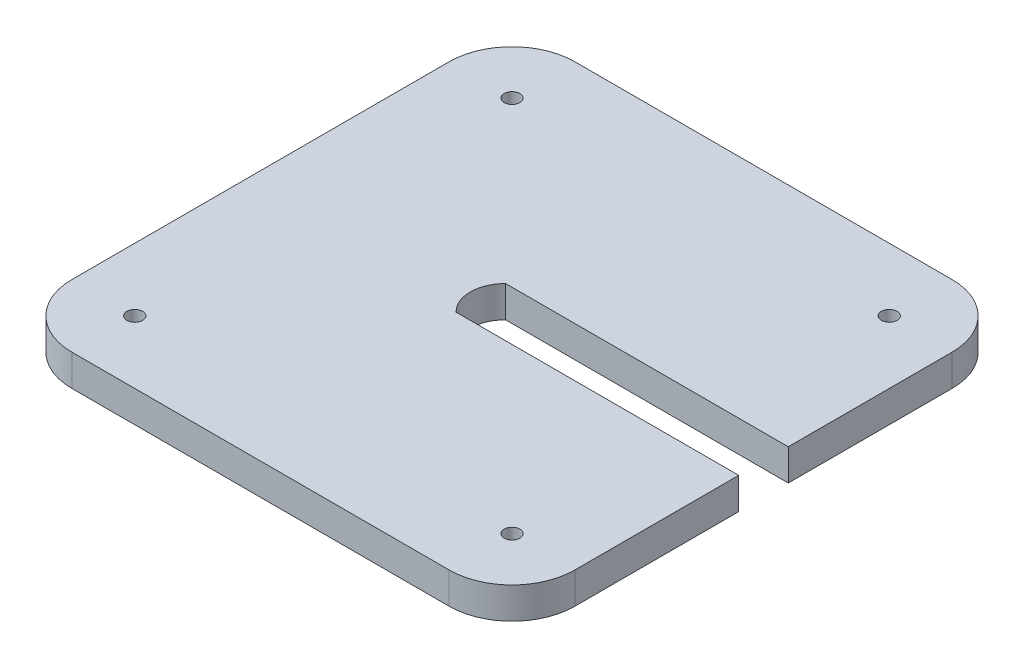
from build123d import *

# Parameters (mm, degrees)
SKETCH1_R           = 1.5875
BOSS_EXTRUDE1_DEPTH = 6.35


with BuildPart() as part:
    # Sketch1 → Boss-Extrude1 (new body)
    with BuildSketch(Plane(origin=(0, 0, 0), x_dir=(1, 0, 0), z_dir=(0, 1, 0))):
        with BuildLine():
            Line((63.451864614, -36.34068615), (63.451864614, -3.24448615))
            ThreePointArc((63.451864614, -3.24448615), (59.732120735, 5.735769971), (50.751864614, 9.45551385))
            Line((50.751864614, 9.45551385), (-25.448135386, 9.45551385))
            ThreePointArc((-25.448135386, 9.45551385), (-34.428391507, 5.735769971), (-38.148135386, -3.24448615))
            Line((-38.148135386, -3.24448615), (-38.148135386, -79.44448615))
            ThreePointArc((-38.148135386, -79.44448615), (-34.428391507, -88.424742271), (-25.448135386, -92.14448615))
            Line((-25.448135386, -92.14448615), (50.751864614, -92.14448615))
            ThreePointArc((50.751864614, -92.14448615), (59.732120735, -88.424742271), (63.451864614, -79.44448615))
            Line((63.451864614, -79.44448615), (63.451864614, -46.34828615))
            Line((63.451864614, -46.34828615), (18.246283087, -46.34828615))
            Line((18.246283087, -46.34828615), (6.358123925, -46.34828615))
            ThreePointArc((6.358123925, -46.34828615), (4.253221481, -41.34448615), (6.358123925, -36.34068615))
            Line((6.358123925, -36.34068615), (18.246283087, -36.34068615))
            Line((18.246283087, -36.34068615), (63.451864614, -36.34068615))
        make_face()
        with Locations(Location((-25.448135386, -79.44448615, 0), (0, 0, 270))):
            Circle(SKETCH1_R, mode=Mode.SUBTRACT)
        with Locations(Location((50.751864614, -79.44448615, 0), (0, 0, 270))):
            Circle(SKETCH1_R, mode=Mode.SUBTRACT)
        with Locations(Location((50.751864614, -3.24448615, 0), (0, 0, 270))):
            Circle(SKETCH1_R, mode=Mode.SUBTRACT)
        with Locations(Location((-25.448135386, -3.24448615, 0), (0, 0, 270))):
            Circle(SKETCH1_R, mode=Mode.SUBTRACT)
    extrude(amount=BOSS_EXTRUDE1_DEPTH)


solid = part.part
